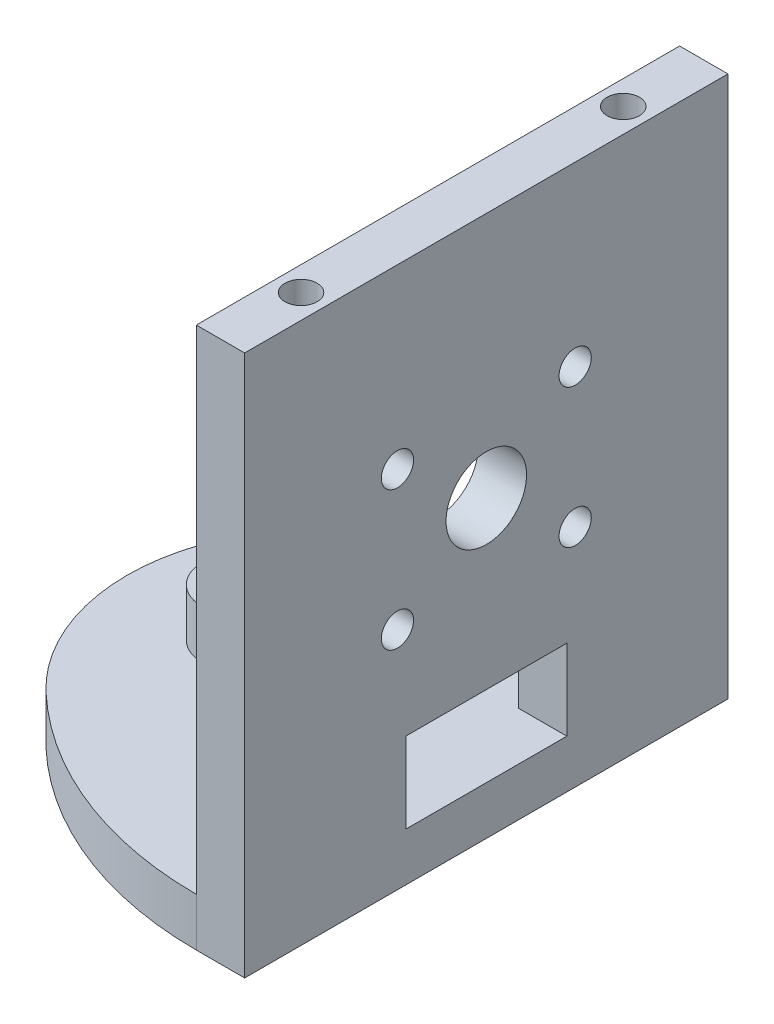
from build123d import *

# Parameters (mm, degrees)
BOSS_EXTRUDE1_DEPTH     = 3
ESQUISSE1_W             = 3
ESQUISSE1_H             = 30
BOSS_EXTRU_1_DEPTH      = 30.6
ESQUISSE2_R             = 1
ENL_V_MAT_EXTRU_1_DEPTH = 3
ESQUISSE3_R             = 2.35
BOSS_EXTRU_2_DEPTH      = 3
ESQUISSE4_R             = 2.5
ENL_V_MAT_EXTRU_2_DEPTH = 40.164397097
ESQUISSE5_R             = 1
ENL_V_MAT_EXTRU_3_DEPTH = 10
SKETCH2_W               = 10
SKETCH2_H               = 5
CUT_EXTRUDE1_DEPTH      = 40.164397097


with BuildPart() as part:
    # Sketch1 → Boss-Extrude1 (new body)
    with BuildSketch(Plane(origin=(0, 0, 0), x_dir=(1, 0, 0), z_dir=(0, 1, 0))):
        with BuildLine():
            Line((15.3, 15), (12.3, 15))
            ThreePointArc((12.3, 15), (3.958234572, 13.40032808), (-3.2, 8.828273999))
            ThreePointArc((-3.2, 8.828273999), (-7, 0), (-3.2, -8.828273999))
            ThreePointArc((-3.2, -8.828273999), (3.958234572, -13.40032808), (12.3, -15))
            Line((12.3, -15), (15.3, -15))
            Line((15.3, -15), (15.3, 15))
        make_face()
    extrude(amount=-BOSS_EXTRUDE1_DEPTH)

    # Esquisse1 → Boss.-Extru.1 (add)
    with BuildSketch(Plane(origin=(0, 0, 0), x_dir=(1, 0, 0), z_dir=(0, 1, 0))):
        with Locations((13.8, 0)):
            Rectangle(ESQUISSE1_W, ESQUISSE1_H)
    extrude(amount=BOSS_EXTRU_1_DEPTH)

    # Esquisse2 → Enlèv. mat.-Extru.1 (cut)
    with BuildSketch(Plane(origin=(0, 30.6, 0), x_dir=(1, 0, 0), z_dir=(0, 1, 0))):
        with Locations(Location((13.8, 10, 0), (0, 0, 270))):
            Circle(ESQUISSE2_R)
        with Locations(Location((13.8, -10, 0), (0, 0, 270))):
            Circle(ESQUISSE2_R)
    extrude(amount=-ENL_V_MAT_EXTRU_1_DEPTH, mode=Mode.SUBTRACT)

    # Esquisse3 → Boss.-Extru.2 (add)
    with BuildSketch(Plane(origin=(0, 0, 0), x_dir=(1, 0, 0), z_dir=(0, 1, 0))):
        with Locations(Location((0, 0, 0), (0, 0, 270))):
            Circle(ESQUISSE3_R)
    extrude(amount=BOSS_EXTRU_2_DEPTH)

    # Esquisse4 → Enlèv. mat.-Extru.2 (cut, through all)
    with BuildSketch(Plane.ZY.offset(-12.3)):
        with Locations((0, 15.3)):
            Circle(ESQUISSE4_R)
    extrude(amount=-ENL_V_MAT_EXTRU_2_DEPTH, mode=Mode.SUBTRACT)

    # Esquisse5 → Enlèv. mat.-Extru.3 (cut)
    with BuildSketch(Plane(origin=(15.3, 0, 0), x_dir=(0, 0, -1), z_dir=(1, 0, 0))):
        with Locations((5.516503864, 19.609081703)):
            Circle(ESQUISSE5_R)
        with Locations((5.515646632, 10.989821091)):
            Circle(ESQUISSE5_R)
        with Locations((-5.515646632, 19.610178909)):
            Circle(ESQUISSE5_R)
        with Locations((-5.516503864, 10.990918297)):
            Circle(ESQUISSE5_R)
    extrude(amount=-ENL_V_MAT_EXTRU_3_DEPTH, mode=Mode.SUBTRACT)

    # Sketch2 → Cut-Extrude1 (cut, through all)
    with BuildSketch(Plane.ZY.offset(-12.3)):
        with Locations((0, 2.5)):
            Rectangle(SKETCH2_W, SKETCH2_H)
    extrude(amount=-CUT_EXTRUDE1_DEPTH, mode=Mode.SUBTRACT)


solid = part.part
